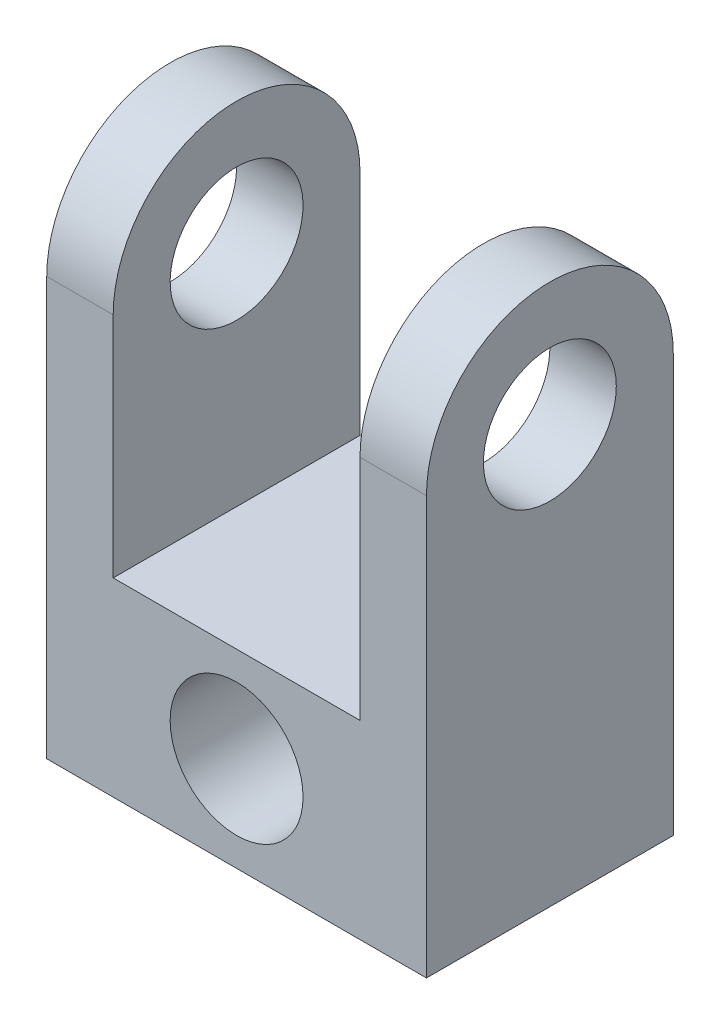
from build123d import *

# Parameters (mm, degrees)
ESBO_O1_R                = 3.5
RESSALTO_EXTRUS_O1_DEPTH = 10
ESBO_O2_R                = 3.5
CORTE_EXTRUS_O1_DEPTH    = 10
ESBO_O3_W                = 13
ESBO_O3_H                = 18.5
CORTE_EXTRUS_O2_DEPTH    = 10


with BuildPart() as part:
    # Esboço1 → Ressalto-extrusão1 (new, symmetric)
    with BuildSketch(Plane(origin=(0, 0, 0), x_dir=(0, 0, -1), z_dir=(1, 0, 0))):
        with BuildLine():
            Line((-6.5, 0), (-6.5, -22))
            Line((-6.5, -22), (6.5, -22))
            Line((6.5, -22), (6.5, 0))
            ThreePointArc((6.5, 0), (0, 6.5), (-6.5, 0))
        make_face()
        Circle(ESBO_O1_R, mode=Mode.SUBTRACT)
    extrude(amount=RESSALTO_EXTRUS_O1_DEPTH, both=True)

    # Esboço2 → Corte-extrusão1 (cut, symmetric)
    with BuildSketch(Plane.XY):
        with Locations(Location((0, -17, 0), (0, 0, 270))):
            Circle(ESBO_O2_R)
    extrude(amount=CORTE_EXTRUS_O1_DEPTH, both=True, mode=Mode.SUBTRACT)

    # Esboço3 → Corte-extrusão2 (cut, symmetric)
    with BuildSketch(Plane.XY):
        with Locations((0, -2.75)):
            Rectangle(ESBO_O3_W, ESBO_O3_H)
    extrude(amount=CORTE_EXTRUS_O2_DEPTH, both=True, mode=Mode.SUBTRACT)


solid = part.part
